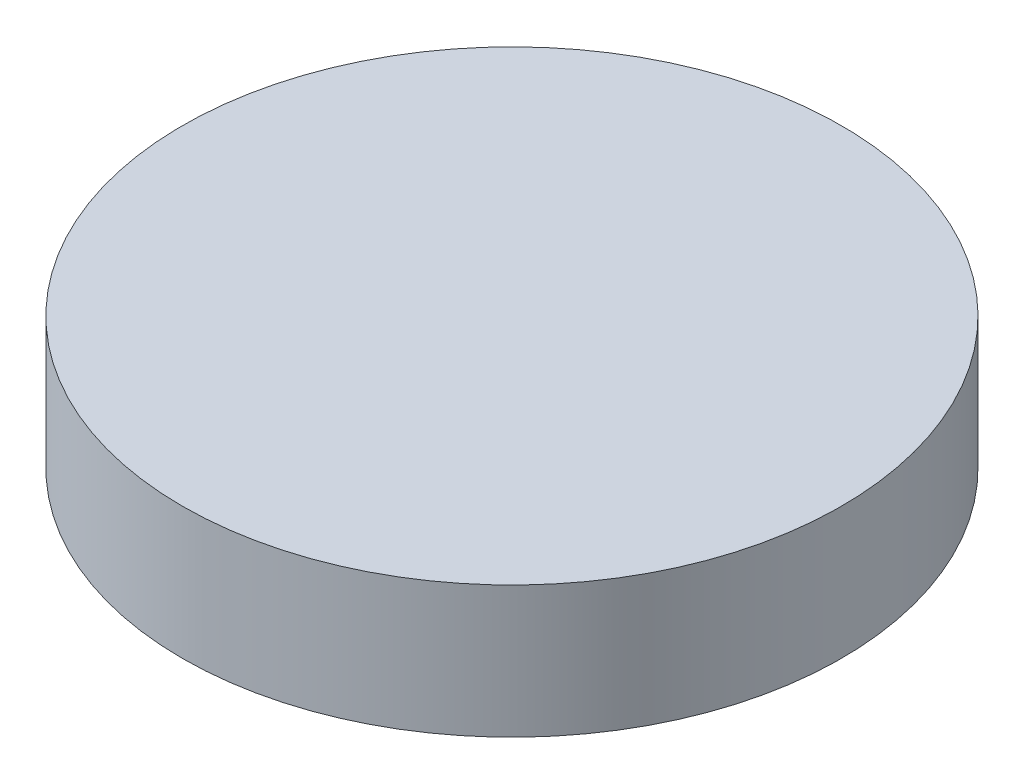
from build123d import *

# Parameters (mm, degrees)
SKETCH3_R           = 25.4
BOSS_EXTRUDE1_DEPTH = 10.16
SKETCH5_R           = 22.249811892
CUT_EXTRUDE1_DEPTH  = 7.62


with BuildPart() as part:
    # Sketch3 → Boss-Extrude1 (new body)
    with BuildSketch(Plane(origin=(0, 0, 0), x_dir=(1, 0, 0), z_dir=(0, 1, 0))):
        with Locations(Location((0, 0, 0), (0, 0, 270))):
            Circle(SKETCH3_R)
    extrude(amount=BOSS_EXTRUDE1_DEPTH)

    # Sketch5 → Cut-Extrude1 (cut)
    with BuildSketch(Plane.XZ):
        with Locations(Location((0, 0, 0), (0, 0, 270))):
            Circle(SKETCH5_R)
    extrude(amount=-CUT_EXTRUDE1_DEPTH, mode=Mode.SUBTRACT)


solid = part.part
